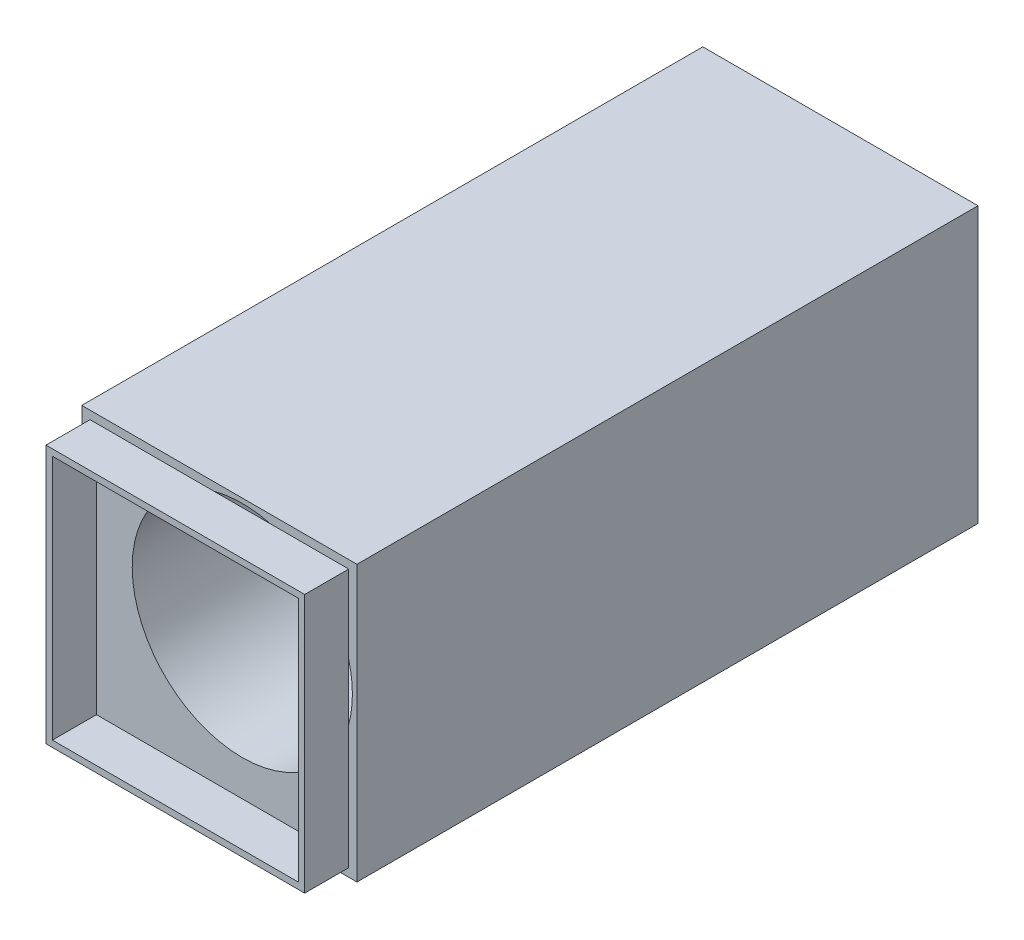
from build123d import *

# Parameters (mm, degrees)
SKETCH1_W           = 76.2
SKETCH1_H           = 76.2
BOSS_EXTRUDE1_DEPTH = 184.15
SKETCH3_W           = 76.2
SKETCH3_H           = 76.2
SKETCH3_W_2         = 71.628
SKETCH3_H_2         = 71.628
SKETCH3_W_3         = 68.072
SKETCH3_H_3         = 68.072
CUT_EXTRUDE2_DEPTH  = 12.192
SKETCH4_R           = 30.48
CUT_EXTRUDE4_DEPTH  = 165.1


with BuildPart() as part:
    # Sketch1 → Boss-Extrude1 (new body)
    with BuildSketch(Plane.XY):
        with Locations((38.1, 38.1)):
            Rectangle(SKETCH1_W, SKETCH1_H)
    extrude(amount=-BOSS_EXTRUDE1_DEPTH)

    # Sketch3 → Cut-Extrude2 (cut)
    # profile 1 of 2: a face of its own
    with BuildSketch(Plane.XY):
        with Locations((38.1, 38.1)):
            Rectangle(SKETCH3_W, SKETCH3_H)
        with Locations((38.1, 38.1)):
            Rectangle(SKETCH3_W_2, SKETCH3_H_2, mode=Mode.SUBTRACT)
    # profile 2 of 2: a face of its own
    with BuildSketch(Plane.XY):
        with Locations((38.1, 38.1)):
            Rectangle(SKETCH3_W_3, SKETCH3_H_3)
    extrude(amount=-CUT_EXTRUDE2_DEPTH, mode=Mode.SUBTRACT)

    # Sketch4 → Cut-Extrude4 (cut)
    with BuildSketch(Plane.XY.offset(-12.192)):
        with Locations((44.45, 44.45)):
            Circle(SKETCH4_R)
    extrude(amount=-CUT_EXTRUDE4_DEPTH, mode=Mode.SUBTRACT)


solid = part.part
